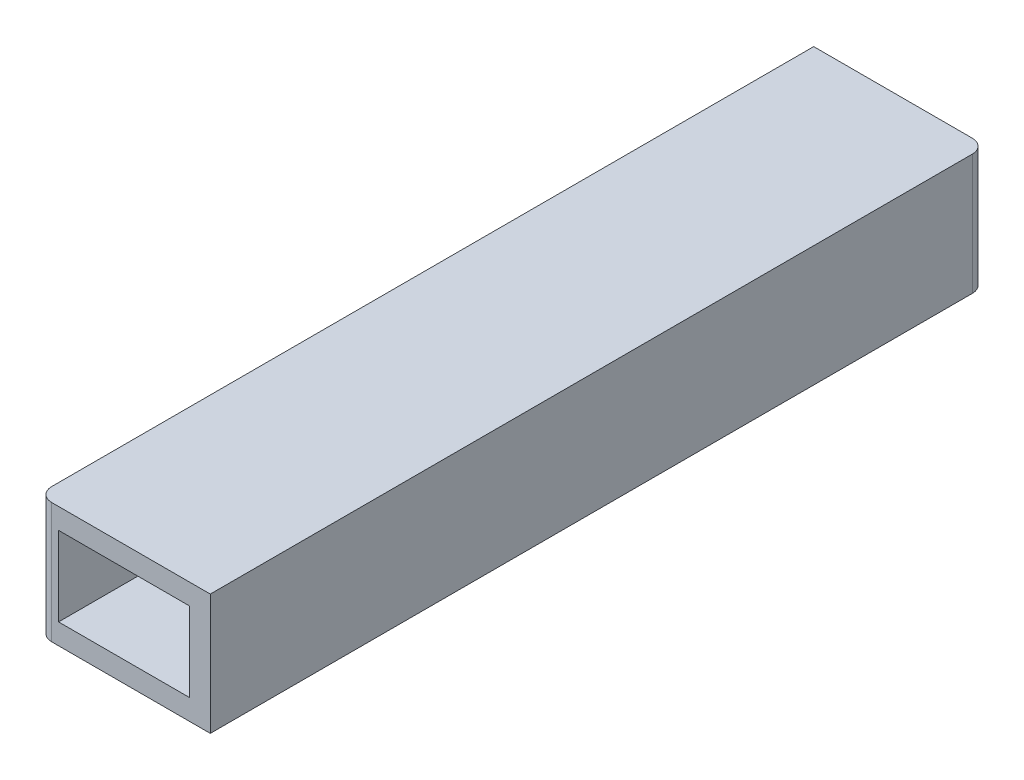
from build123d import *

# Parameters (mm, degrees)
SKETCH_2_W          = 100
SKETCH_2_H          = 70
EXTRUDE_1_DEPTH     = 450
SKETCH_3_W          = 76
SKETCH_3_H          = 46
CUT_EXTRUDE_1_DEPTH = 420
SKETCH_4_W          = 76
SKETCH_4_H          = 46
CUT_EXTRUDE_2_DEPTH = 30
FILLET_1_R          = 8
FILLET_3_R          = 8


with BuildPart() as part:
    # 草图2 → 凸台-拉伸1 (new body)
    with BuildSketch(Plane.XY):
        Rectangle(SKETCH_2_W, SKETCH_2_H)
    extrude(amount=EXTRUDE_1_DEPTH)

    # 草图3 → 切除-拉伸1 (cut)
    with BuildSketch(Plane(origin=(0, 0, 0), x_dir=(-1, 0, 0), z_dir=(0, 0, -1))):
        Rectangle(SKETCH_3_W, SKETCH_3_H)
    extrude(amount=-CUT_EXTRUDE_1_DEPTH, mode=Mode.SUBTRACT)

    # 草图4 → 切除-拉伸2 (cut)
    with BuildSketch(Plane.XY.offset(450)):
        Rectangle(SKETCH_4_W, SKETCH_4_H)
    extrude(amount=-CUT_EXTRUDE_2_DEPTH, mode=Mode.SUBTRACT)

    # 圆角1
    fillet_1_edges = [part.edges().sort_by_distance(p)[0] for p in [
        (50, 0, 0),
    ]]
    fillet(fillet_1_edges, radius=FILLET_1_R)

    # 圆角3
    fillet_3_edges = [part.edges().sort_by_distance(p)[0] for p in [
        (-50, 0, 450),
    ]]
    fillet(fillet_3_edges, radius=FILLET_3_R)


solid = part.part
